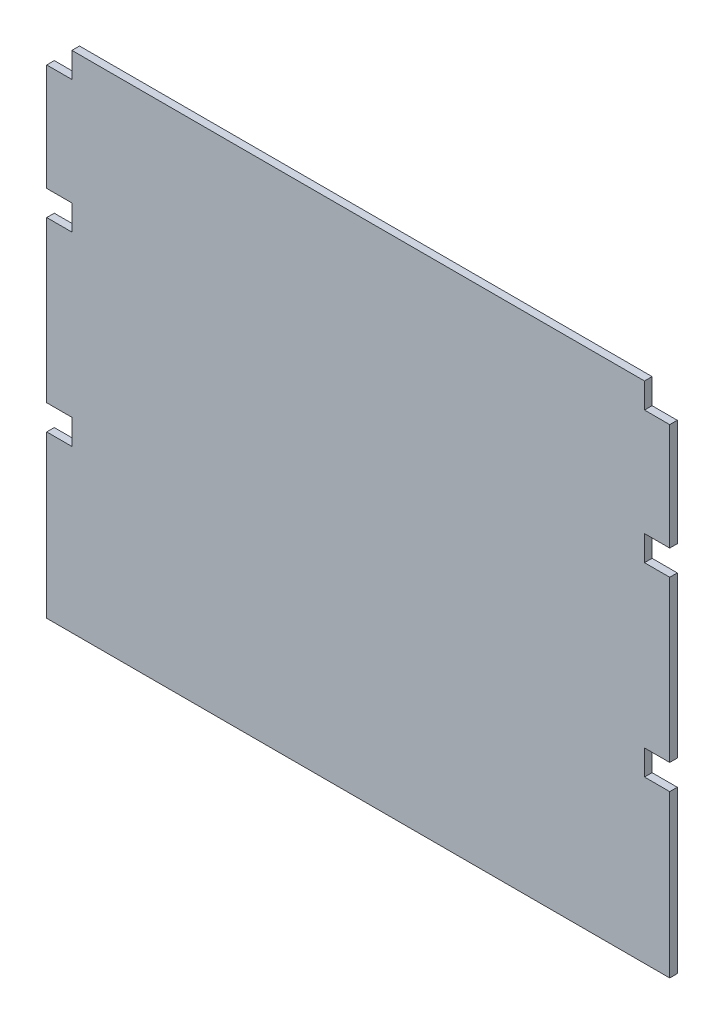
from build123d import *

# Parameters (mm, degrees)
ESQUISSE1_W             = 247
ESQUISSE1_H             = 200
BOSS_EXTRU_1_DEPTH      = 3
ESQUISSE2_W             = 10
ESQUISSE2_H             = 10
ENL_V_MAT_EXTRU_1_DEPTH = 318.833289635


with BuildPart() as part:
    # Esquisse1 → Boss.-Extru.1 (new body)
    with BuildSketch(Plane.XY):
        with Locations((123.5, 100)):
            Rectangle(ESQUISSE1_W, ESQUISSE1_H)
    extrude(amount=BOSS_EXTRU_1_DEPTH)

    # Esquisse2 → Enlèv. mat.-Extru.1 (cut, through all)
    with BuildSketch(Plane.XY.offset(3)):
        with Locations((242, 195)):
            Rectangle(ESQUISSE2_W, ESQUISSE2_H)
        with Locations((242, 142.6)):
            Rectangle(ESQUISSE2_W, ESQUISSE2_H)
        with Locations((242, 69)):
            Rectangle(ESQUISSE2_W, ESQUISSE2_H)
        with Locations((5, 69)):
            Rectangle(ESQUISSE2_W, ESQUISSE2_H)
        with Locations((5, 142.6)):
            Rectangle(ESQUISSE2_W, ESQUISSE2_H)
        with Locations((5, 195)):
            Rectangle(ESQUISSE2_W, ESQUISSE2_H)
    extrude(amount=-ENL_V_MAT_EXTRU_1_DEPTH, mode=Mode.SUBTRACT)


solid = part.part
